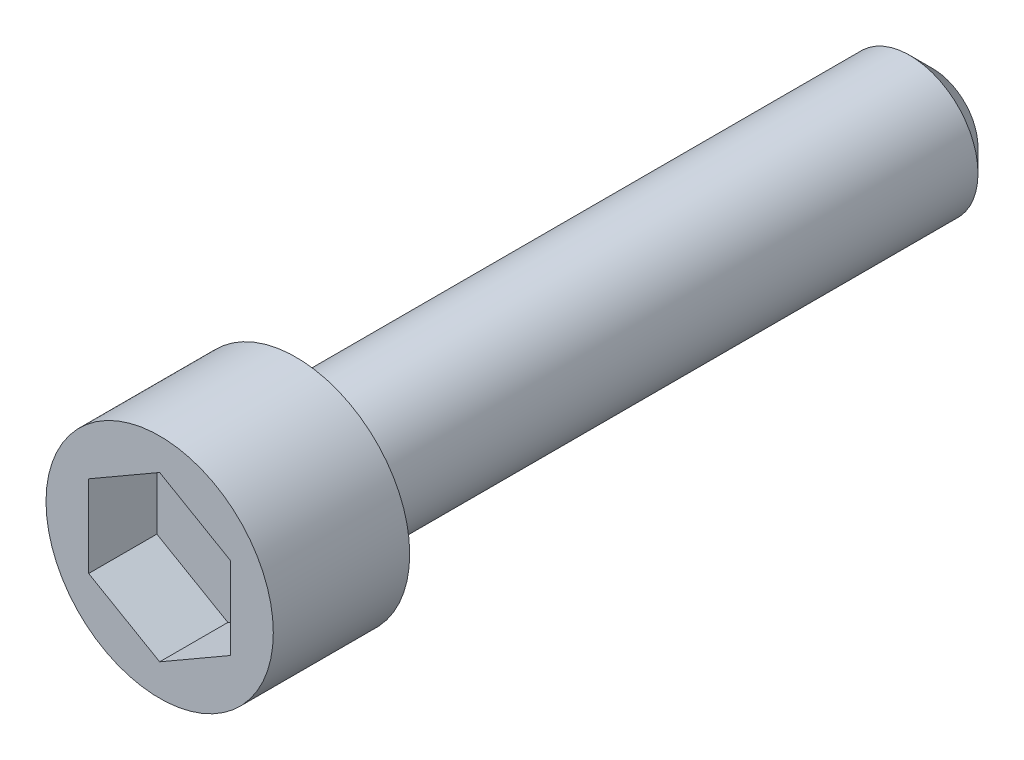
from build123d import *

# Parameters (mm, degrees)
SKETCH_1_R          = 1.5
EXTRUDE_1_DEPTH     = 14
SKETCH_2_R          = 2.5
EXTRUDE_2_DEPTH     = 3
CUT_EXTRUDE_1_DEPTH = 1.5
CHAMFER_1_SIZE      = 0.5


with BuildPart() as part:
    # 草图1 → 凸台-拉伸1 (new body)
    with BuildSketch(Plane.XY):
        Circle(SKETCH_1_R)
    extrude(amount=EXTRUDE_1_DEPTH)

    # 草图2 → 凸台-拉伸2 (add)
    with BuildSketch(Plane.XY.offset(14)):
        Circle(SKETCH_2_R)
    extrude(amount=EXTRUDE_2_DEPTH)

    # 草图3 → 切除-拉伸1 (cut)
    with BuildSketch(Plane.XY.offset(17)):
        Polygon((0, 1.803382283), (-1.56177487, 0.901691141), (-1.56177487, -0.901691141), (0, -1.803382283), (1.56177487, -0.901691141), (1.56177487, 0.901691141), align=None)
    extrude(amount=-CUT_EXTRUDE_1_DEPTH, mode=Mode.SUBTRACT)

    # 倒角1
    chamfer_1_edges = [part.edges().sort_by_distance(p)[0] for p in [
        (-1.5, 0, 0),
    ]]
    chamfer(chamfer_1_edges, length=CHAMFER_1_SIZE)


solid = part.part
